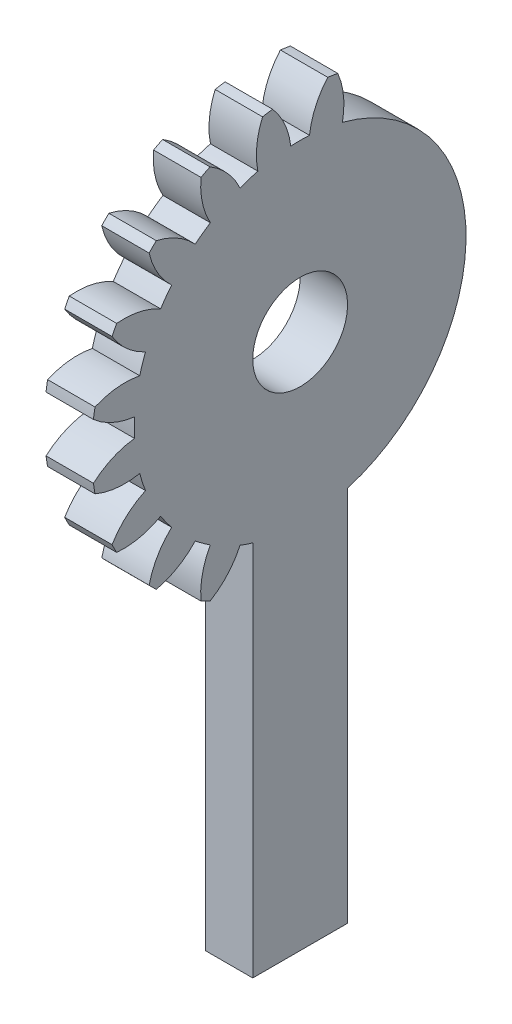
from build123d import *

# Parameters (mm, degrees)
BASPROSKE_W         = 5
BASPROSKE_H         = 22
TOOTHCUT_DEPTH      = 32.511902513
TEETHCUTS_COUNT     = 20
TEETHCUTS_ANGLE     = 342
BORSKE_R            = 2
BORE_DEPTH          = 50.0000508
SKETCH1_W           = 10
SKETCH1_H           = 40
BOSS_EXTRUDE1_DEPTH = 5
CUT_EXTRUDE1_DEPTH  = 61.779759056
SKETCH4_R           = 17.499
BOSS_EXTRUDE2_DEPTH = 5
SKETCH5_R           = 5
CUT_EXTRUDE2_DEPTH  = 5


with BuildPart() as part:
    # BasProSke → Base-Revolve (revolve)
    with BuildSketch(Plane(origin=(0, 0, 0), x_dir=(1, 0, 0), z_dir=(0, 1, 0)), mode=Mode.PRIVATE) as base_revolve_sk:
        with Locations((2.5, 11)):
            Rectangle(BASPROSKE_W, BASPROSKE_H)
    revolve(base_revolve_sk.sketch.rotate(Axis((-10, 0, 0), (1, 0, 0)), 180), axis=Axis((-10, 0, 0), (1, 0, 0)))

    # TooCutSke → ToothCut (cut, through all)
    with BuildSketch(Plane(origin=(0, 0, 0), x_dir=(0, 0, -1), z_dir=(1, 0, 0))):
        with BuildLine():
            ThreePointArc((0.986171591, 17.471189616), (0, 17.499), (-0.986171591, 17.471189616))
            ThreePointArc((-0.986171591, 17.471189616), (-1.626916196, 19.798789858), (-2.932850173, 21.829260982))
            ThreePointArc((-2.932850173, 21.829260982), (0, 22.0254), (2.932850173, 21.829260982))
            ThreePointArc((2.932850173, 21.829260982), (1.626916196, 19.798789858), (0.986171591, 17.471189616))
        make_face()
    toothcut = extrude(amount=TOOTHCUT_DEPTH, mode=Mode.SUBTRACT)

    # TeethCuts: ToothCut ×20 about axis
    teethcuts_axis = Axis((-10, 0, 0), (1, 0, 0))
    for i in range(1, TEETHCUTS_COUNT):
        add(toothcut.rotate(teethcuts_axis, i * TEETHCUTS_ANGLE / (TEETHCUTS_COUNT - 1)), mode=Mode.SUBTRACT)

    # BorSke → Bore (cut, symmetric)
    with BuildSketch(Plane(origin=(0, 0, 0), x_dir=(0, 0, -1), z_dir=(1, 0, 0))):
        with Locations(Location((0, 0, 0), (0, 0, 180))):
            Circle(BORSKE_R)
    extrude(amount=BORE_DEPTH, both=True, mode=Mode.SUBTRACT)

    # Sketch1 → Boss-Extrude1 (add)
    with BuildSketch(Plane.ZY):
        with Locations((0, -36.512502254)):
            Rectangle(SKETCH1_W, SKETCH1_H)
    extrude(amount=-BOSS_EXTRUDE1_DEPTH)

    # Sketch2 → Cut-Extrude1 (cut, through all)
    with BuildSketch(Plane.ZY):
        Polygon((-5, -16.76946633), (-4.460989585, 16.920832513), (-7.792643155, 24.285727196), (-28.634173903, 9.783095201), (-18.213408529, -22.103486404), (-10.962092532, -23.448101291), align=None)
    extrude(amount=-CUT_EXTRUDE1_DEPTH, mode=Mode.SUBTRACT)

    # Sketch4 → Boss-Extrude2 (add)
    with BuildSketch(Plane.ZY):
        Circle(SKETCH4_R)
    extrude(amount=-BOSS_EXTRUDE2_DEPTH)

    # Sketch5 → Cut-Extrude2 (cut)
    with BuildSketch(Plane.ZY):
        Circle(SKETCH5_R)
    extrude(amount=-CUT_EXTRUDE2_DEPTH, mode=Mode.SUBTRACT)


solid = part.part
